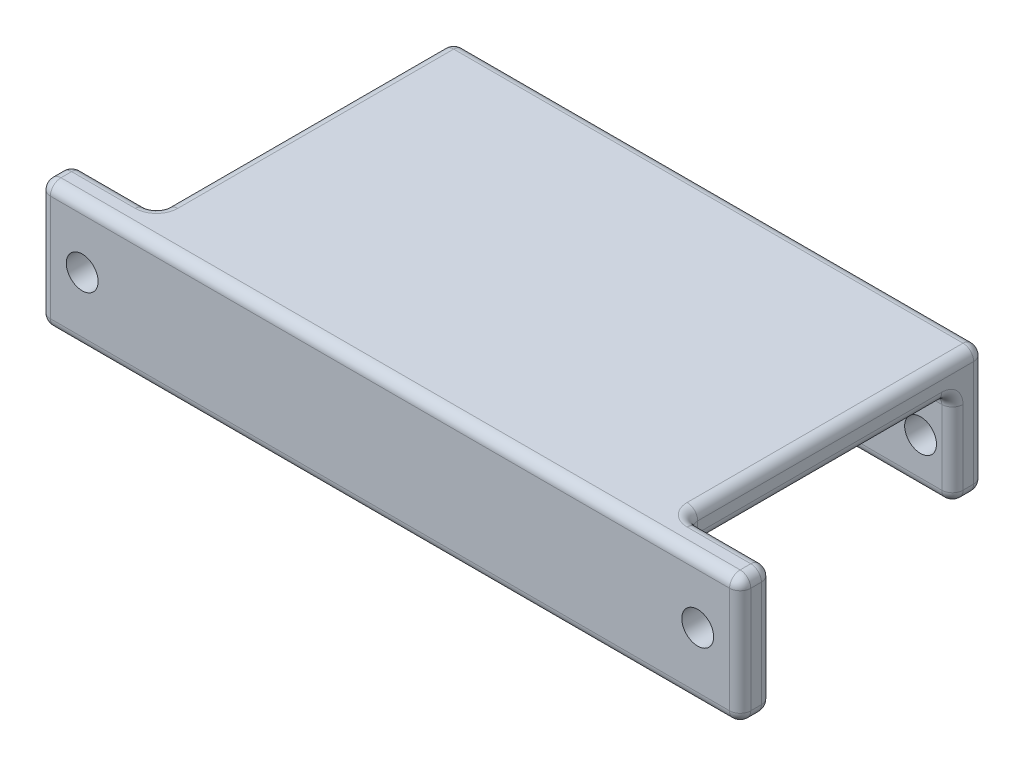
from build123d import *

# Parameters (mm, degrees)
SCHIZZO1_W                   = 50
SCHIZZO1_H                   = 12
ESTRUSIONE_ESTRUSIONE1_DEPTH = 3
SCHIZZO2_W                   = 50
SCHIZZO2_H                   = 3
ESTRUSIONE_ESTRUSIONE2_DEPTH = 25
SCHIZZO3_W                   = 66
SCHIZZO3_H                   = 12
ESTRUSIONE_ESTRUSIONE3_DEPTH = 3
SCHIZZO5_R                   = 1.5
TAGLIO_ESTRUSIONE1_DEPTH     = 6
SCHIZZO6_R                   = 1.5
TAGLIO_ESTRUSIONE2_DEPTH     = 6
RACCORDO1_R                  = 1


with BuildPart() as part:
    # Schizzo1 → Estrusione-Estrusione1 (new body)
    with BuildSketch(Plane.XY):
        Rectangle(SCHIZZO1_W, SCHIZZO1_H)
    extrude(amount=ESTRUSIONE_ESTRUSIONE1_DEPTH)

    # Schizzo2 → Estrusione-Estrusione2 (add)
    with BuildSketch(Plane.XY.offset(3)):
        with Locations((0, 4.5)):
            Rectangle(SCHIZZO2_W, SCHIZZO2_H)
    extrude(amount=ESTRUSIONE_ESTRUSIONE2_DEPTH)

    # Schizzo3 → Estrusione-Estrusione3 (add)
    with BuildSketch(Plane.XY.offset(28)):
        Rectangle(SCHIZZO3_W, SCHIZZO3_H)
    extrude(amount=ESTRUSIONE_ESTRUSIONE3_DEPTH)

    # Schizzo5 → Taglio-Estrusione1 (cut)
    with BuildSketch(Plane.XY.offset(31)):
        with Locations((29, 0.28)):
            Circle(SCHIZZO5_R)
        with Locations((-29, 0.28)):
            Circle(SCHIZZO5_R)
    extrude(amount=-TAGLIO_ESTRUSIONE1_DEPTH, mode=Mode.SUBTRACT)

    # Schizzo6 → Taglio-Estrusione2 (cut)
    with BuildSketch(Plane(origin=(0, 0, 0), x_dir=(-1, 0, 0), z_dir=(0, 0, -1))):
        with Locations((-22, -1.5)):
            Circle(SCHIZZO6_R)
        with Locations(Location((22, -1.5, 0), (0, 0, 180))):
            Circle(SCHIZZO6_R)
    extrude(amount=-TAGLIO_ESTRUSIONE2_DEPTH, mode=Mode.SUBTRACT)

    # Raccordo1
    raccordo1_edges = [part.edges().sort_by_distance(p)[0] for p in [
        (-25, -1.5, 3),
        (0, -6, 3),
        (0, 3, 3),
        (-25, 3, 15.5),
        (25, 3, 15.5),
        (-25, 4.5, 28),
        (0, 3, 28),
        (25, 4.5, 28),
        (33, 0, 28),
        (33, -6, 29.5),
        (29, 6, 28),
        (-29, 6, 28),
        (33, 6, 29.5),
        (-33, 0, 28),
        (-33, 6, 29.5),
        (0, -6, 28),
        (-33, -6, 29.5),
        (33, 0, 31),
        (0, 6, 31),
        (-33, 0, 31),
        (0, -6, 31),
        (25, -1.5, 3),
        (0, -6, 0),
        (-25, 0, 0),
        (0, 6, 0),
        (25, 0, 0),
        (25, -6, 1.5),
        (-25, -6, 1.5),
        (-25, 6, 14),
        (25, 6, 14),
    ]]
    fillet(raccordo1_edges, radius=RACCORDO1_R)


solid = part.part
